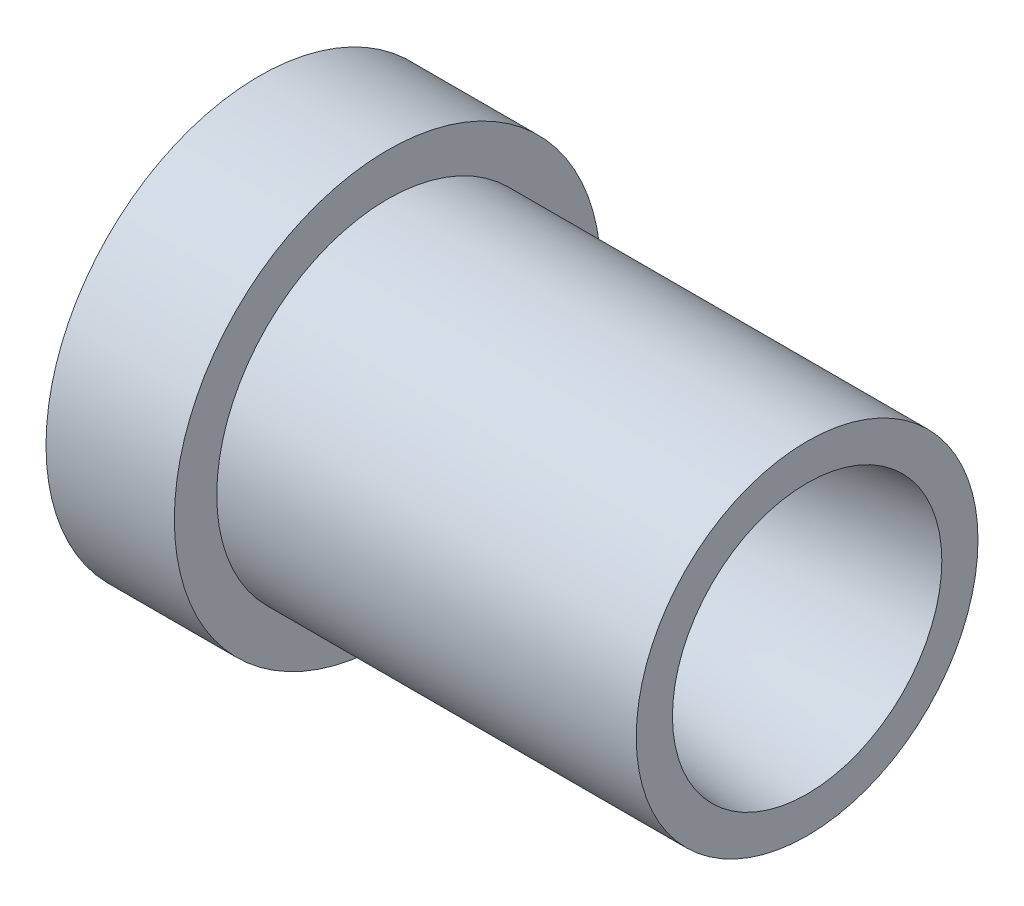
from build123d import *


with BuildPart() as part:
    # Sketch1 → Revolve1 (revolve)
    with BuildSketch(Plane.XY, mode=Mode.PRIVATE) as revolve1_sk:
        with BuildLine():
            Line((-22.48672668, 38.1), (-35.18672668, 38.1))
            Line((-35.18672668, 38.1), (-35.18672668, 44.323))
            Line((-35.18672668, 44.323), (-8.51672668, 44.323))
            Line((-8.51672668, 44.323), (-8.51672668, 35.5092))
            Line((-8.51672668, 35.5092), (78.657926453, 35.5092))
            Line((78.657926453, 35.5092), (78.657926453, 27.9908))
            add(Edge.make_bspline(
                [(-22.48672668, 38.1), (-22.370356861, 38.09897388), (-22.137617212, 38.096921641), (-21.78883339, 38.080327111), (-21.440700568, 38.053854343), (-21.093543503, 38.016557388), (-20.74768602, 37.968731147), (-20.403450755, 37.91035045), (-20.061158792, 37.841488555), (-19.721129451, 37.762204619), (-19.383679924, 37.672573912), (-19.049124958, 37.57267979), (-18.717776663, 37.462615419), (-18.389944097, 37.342483534), (-18.065933107, 37.212396112), (-17.746045893, 37.072474607), (-17.430580883, 36.922849446), (-17.11983234, 36.763660254), (-16.814090128, 36.595055503), (-16.513639459, 36.417192477), (-16.218760597, 36.230237084), (-15.929728606, 36.034363742), (-15.646813104, 35.829755152), (-15.370277996, 35.616602171), (-15.100381265, 35.395103606), (-14.837374632, 35.165466125), (-14.581503429, 34.927903948), (-14.333006388, 34.682638616), (-14.092115305, 34.429898936), (-13.859054833, 34.16992072), (-13.634042456, 33.902946399), (-13.417287983, 33.629225095), (-13.208993675, 33.349012066), (-13.009353819, 33.06256874), (-12.818554487, 32.770162339), (-12.63677442, 32.472065382), (-12.46418014, 32.168557049), (-12.300944211, 31.859916207), (-12.147175782, 31.546446579), (-12.003178938, 31.228381675), (-11.868488722, 30.906237874), (-11.707728514, 30.479262811), (-11.51732689, 29.949147874), (-11.287330166, 29.319466301), (-11.058243338, 28.689458089), (-10.828912694, 28.0595374), (-10.599647364, 27.429593267), (-10.370364598, 26.799655394), (-10.141086446, 26.169715856), (-9.911807079, 25.539776759), (-9.682528012, 24.909837557), (-9.453248915, 24.279898367), (-9.223969775, 23.649959192), (-8.994690752, 23.020019971), (-8.765411249, 22.390080926), (-8.536133555, 21.760141234), (-8.306849289, 21.130203891), (-8.077589317, 20.500257863), (-7.848238738, 19.870344215), (-7.619226341, 19.240309716), (-7.388951901, 18.610726192), (-7.203772618, 18.0924821), (-7.050725438, 17.690209546), (-6.926500885, 17.405737457), (-6.791372669, 17.126326499), (-6.644826713, 16.852710937), (-6.487303844, 16.585271882), (-6.319012214, 16.324472291), (-6.140245146, 16.070739401), (-5.951295216, 15.824495391), (-5.752476857, 15.586148163), (-5.544119378, 15.356093132), (-5.326568454, 15.134711683), (-5.100184794, 14.92237094), (-4.865343728, 14.719423101), (-4.622434808, 14.526204554), (-4.371860704, 14.343035849), (-4.114037025, 14.170220608), (-3.849391254, 14.008045488), (-3.57836228, 13.856779357), (-3.301399487, 13.71667311), (-3.018962187, 13.587958994), (-2.731518701, 13.470850518), (-2.4395457, 13.365541833), (-2.143527323, 13.272207607), (-1.84395447, 13.191002668), (-1.541323896, 13.122061095), (-1.236137392, 13.065499653), (-0.9289012, 13.02140299), (-0.620124168, 12.989878407), (-0.310320711, 12.970850368), (-0.020680283, 12.965229082), (0.248254878, 12.968772306), (0.496363247, 12.977806365), (0.744174099, 12.992980091), (0.991540862, 13.014182722), (1.238316013, 13.041426715), (1.484350236, 13.074696966), (1.729504434, 13.113944035), (1.973603072, 13.159261448), (2.216609324, 13.210183939), (2.741108155, 13.336511416), (3.546225146, 13.540917433), (4.635103679, 13.810886776), (5.723582618, 14.08216045), (6.812168643, 14.352667031), (7.900726018, 14.622873913), (8.989291105, 14.892568408), (10.077854183, 15.161719913), (11.166417874, 15.430249095), (12.254981464, 15.698089726), (13.343545159, 15.96517198), (14.432108907, 16.23142704), (15.520672729, 16.49678579), (16.609236611, 16.761179295), (17.697800593, 17.024538387), (18.786364665, 17.286794115), (19.874928833, 17.547877422), (20.963493102, 17.807719276), (22.052057473, 18.066250654), (23.140621957, 18.323402462), (24.229186548, 18.579105746), (25.317751275, 18.833291384), (26.406316136, 19.085890404), (27.494881125, 19.336833785), (28.583446277, 19.586052369), (29.672011553, 19.833477309), (30.760576999, 20.079039368), (31.849142586, 20.322669685), (32.93770836, 20.564299058), (34.026274304, 20.803858594), (35.114840433, 21.041279179), (36.203406751, 21.276491794), (37.291973258, 21.509427416), (38.38053997, 21.740016935), (39.469106873, 21.968191446), (40.557674, 22.193881789), (41.646241362, 22.417018943), (42.73480894, 22.637533965), (43.823376761, 22.855357718), (44.911944827, 23.070421178), (46.000513128, 23.282655353), (47.089081692, 23.491991155), (48.177650515, 23.698359593), (49.266219622, 23.901691587), (50.354789007, 24.101918108), (51.443358679, 24.298970117), (52.531928645, 24.492778575), (53.620498905, 24.683274445), (54.709069477, 24.870388679), (55.797640354, 25.054052306), (56.886211583, 25.234196124), (57.974783131, 25.410751265), (59.063355022, 25.583648611), (60.151927263, 25.752819113), (61.240499857, 25.918193698), (62.329072801, 26.079703464), (63.417646132, 26.237279179), (64.506219844, 26.390851938), (65.594793944, 26.540352674), (66.683368441, 26.685712313), (67.771943341, 26.826861819), (68.860518645, 26.963732162), (69.949094372, 27.096254247), (71.037670511, 27.224359253), (72.126247141, 27.34797742), (73.214824057, 27.467042076), (74.303402002, 27.581475559), (75.391978236, 27.691241067), (76.480563035, 27.796148979), (77.569118074, 27.896580053), (78.295038811, 27.959397546), (78.657926453, 27.9908)],
                knots=[0, 0, 0, 0, 0.002987351, 0.005974702, 0.008962053, 0.011949404, 0.014936754, 0.017924105, 0.020911456, 0.023898807, 0.026886158, 0.029873509, 0.03286086, 0.035848211, 0.038835562, 0.041822913, 0.044810263, 0.047797614, 0.050784965, 0.053772316, 0.056759667, 0.059747018, 0.062734369, 0.06572172, 0.068709071, 0.071696422, 0.074683773, 0.077671124, 0.080658475, 0.083645825, 0.086633176, 0.089620527, 0.092607878, 0.095595229, 0.09858258, 0.101569931, 0.104557282, 0.107544633, 0.110531983, 0.113519334, 0.116506685, 0.119494036, 0.125230633, 0.130967229, 0.136703825, 0.142440421, 0.148177017, 0.153913614, 0.15965021, 0.165386806, 0.171123402, 0.176859998, 0.182596595, 0.188333191, 0.194069787, 0.199806383, 0.20554298, 0.211279576, 0.217016172, 0.222752768, 0.228489365, 0.234225961, 0.236881304, 0.239536646, 0.242191989, 0.244847332, 0.247502675, 0.250158017, 0.25281336, 0.255468703, 0.258124046, 0.260779388, 0.263434731, 0.266090074, 0.268745417, 0.271400759, 0.274056102, 0.276711445, 0.279366788, 0.28202213, 0.284677473, 0.287332816, 0.289988159, 0.292643501, 0.295298844, 0.297954187, 0.30060953, 0.303264872, 0.305920215, 0.308575558, 0.311230901, 0.313886243, 0.316010611, 0.31813498, 0.320259348, 0.322383716, 0.324508084, 0.326632452, 0.32875682, 0.330881188, 0.333005557, 0.335129925, 0.344730434, 0.354330518, 0.363930033, 0.373528837, 0.38312679, 0.392723749, 0.402319575, 0.411914129, 0.421507273, 0.431098868, 0.440688779, 0.45027687, 0.459863008, 0.469447062, 0.479028899, 0.488608391, 0.498185412, 0.507759834, 0.517331536, 0.526900396, 0.536466294, 0.546029114, 0.555588741, 0.565145064, 0.574697973, 0.584247361, 0.593793126, 0.603335165, 0.612873382, 0.622407682, 0.631937973, 0.641464168, 0.650986183, 0.660503936, 0.670017352, 0.679526355, 0.689030879, 0.698530857, 0.708026229, 0.717516937, 0.727002931, 0.736484163, 0.745960589, 0.755432172, 0.764898879, 0.774360681, 0.783817556, 0.793269485, 0.802716458, 0.812158466, 0.82159551, 0.831027593, 0.840454726, 0.849876926, 0.859294215, 0.868706623, 0.878114185, 0.887516943, 0.896914946, 0.906308248, 0.915696912, 0.925081007, 0.934460609, 0.943835802, 0.953206678, 0.962573334, 0.971935876, 0.981294419, 0.990649083, 1, 1, 1, 1], degree=3))
        make_face()
    revolve(revolve1_sk.sketch.rotate(Axis((-35.18672668, 0, 0), (1, 0, 0)), 90), axis=Axis((-35.18672668, 0, 0), (1, 0, 0)))


solid = part.part
